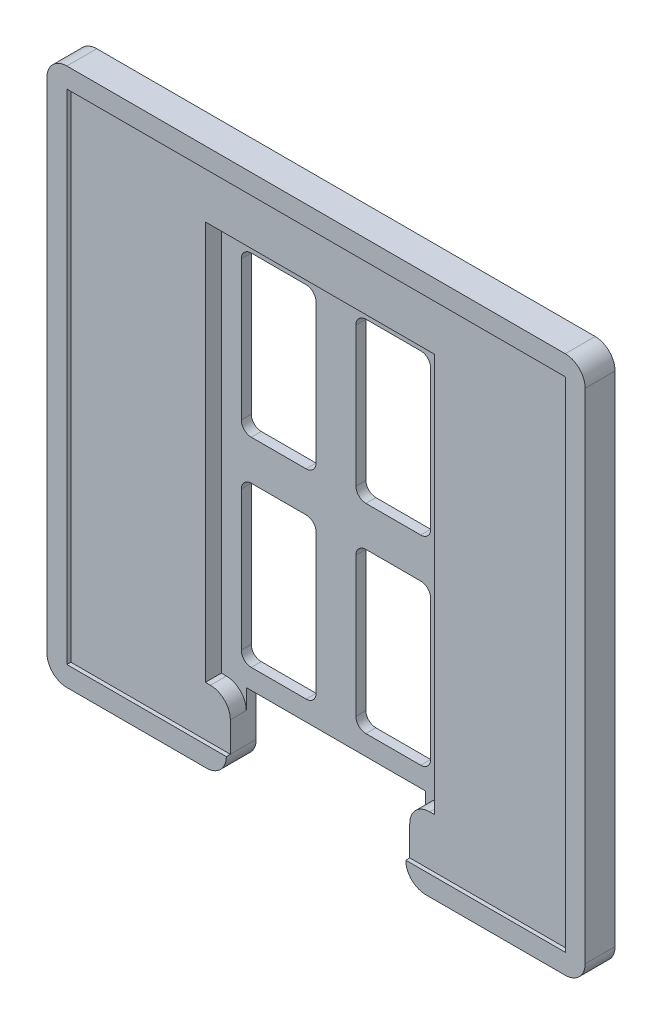
from build123d import *

# Parameters (mm, degrees)
SKETCH_1_W          = 54
SKETCH_1_H          = 54
EXTRUDE_1_DEPTH     = 3
SKETCH_2_W          = 23
SKETCH_2_H          = 40
CUT_EXTRUDE_1_DEPTH = 2
SKETCH_3_W          = 50
SKETCH_3_H          = 50
CUT_EXTRUDE_2_DEPTH = 0.4
SKETCH_4_W          = 18
SKETCH_4_H          = 7
CUT_EXTRUDE_3_DEPTH = 39.301436004
SKETCH_5_W          = 7.5
SKETCH_5_H          = 16
CUT_EXTRUDE_4_DEPTH = 39.236108589
FILLET_1_R          = 2
FILLET_2_R          = 1
FILLET_3_R          = 2


with BuildPart() as part:
    # Эскиз1 → Бобышка-Вытянуть1 (new body)
    with BuildSketch(Plane.XY):
        Rectangle(SKETCH_1_W, SKETCH_1_H)
    extrude(amount=EXTRUDE_1_DEPTH)

    # Эскиз2 → Вырез-Вытянуть1 (cut)
    with BuildSketch(Plane.XY.offset(3)):
        Rectangle(SKETCH_2_W, SKETCH_2_H)
    extrude(amount=-CUT_EXTRUDE_1_DEPTH, mode=Mode.SUBTRACT)

    # Эскиз3 → Вырез-Вытянуть2 (cut)
    with BuildSketch(Plane.XY.offset(3)):
        Rectangle(SKETCH_3_W, SKETCH_3_H)
    extrude(amount=-CUT_EXTRUDE_2_DEPTH, mode=Mode.SUBTRACT)

    # Эскиз4 → Вырез-Вытянуть3 (cut, through all)
    with BuildSketch(Plane.XY.offset(3)):
        with Locations((0, -23.5)):
            Rectangle(SKETCH_4_W, SKETCH_4_H)
    extrude(amount=-CUT_EXTRUDE_3_DEPTH, mode=Mode.SUBTRACT)

    # Эскиз5 → Вырез-Вытянуть4 (cut, through all)
    with BuildSketch(Plane.XY.offset(1)):
        with Locations((-5.75, 10)):
            Rectangle(SKETCH_5_W, SKETCH_5_H)
        with Locations((5.75, 10)):
            Rectangle(SKETCH_5_W, SKETCH_5_H)
        with Locations((-5.75, -10)):
            Rectangle(SKETCH_5_W, SKETCH_5_H)
        with Locations((5.75, -10)):
            Rectangle(SKETCH_5_W, SKETCH_5_H)
    extrude(amount=-CUT_EXTRUDE_4_DEPTH, mode=Mode.SUBTRACT)

    # Скругление1
    fillet_1_edges = [part.edges().sort_by_distance(p)[0] for p in [
        (9, -27, 1.5),
        (9, -20, 1.8),
        (-9, -27, 1.5),
        (-9, -20, 1.8),
    ]]
    fillet(fillet_1_edges, radius=FILLET_1_R)

    # Скругление2
    fillet_2_edges = [part.edges().sort_by_distance(p)[0] for p in [
        (2, -18, 0.5),
        (2, -2, 0.5),
        (9.5, -2, 0.5),
        (9.5, -18, 0.5),
        (-2, 18, 0.5),
        (-2, 2, 0.5),
        (-9.5, 2, 0.5),
        (-9.5, 18, 0.5),
        (9.5, 2, 0.5),
        (2, 2, 0.5),
        (2, 18, 0.5),
        (9.5, 18, 0.5),
        (-9.5, -2, 0.5),
        (-2, -2, 0.5),
        (-2, -18, 0.5),
        (-9.5, -18, 0.5),
    ]]
    fillet(fillet_2_edges, radius=FILLET_2_R)

    # Скругление3
    fillet_3_edges = [part.edges().sort_by_distance(p)[0] for p in [
        (27, -27, 1.5),
        (-27, -27, 1.5),
        (-27, 27, 1.5),
        (27, 27, 1.5),
    ]]
    fillet(fillet_3_edges, radius=FILLET_3_R)


solid = part.part
